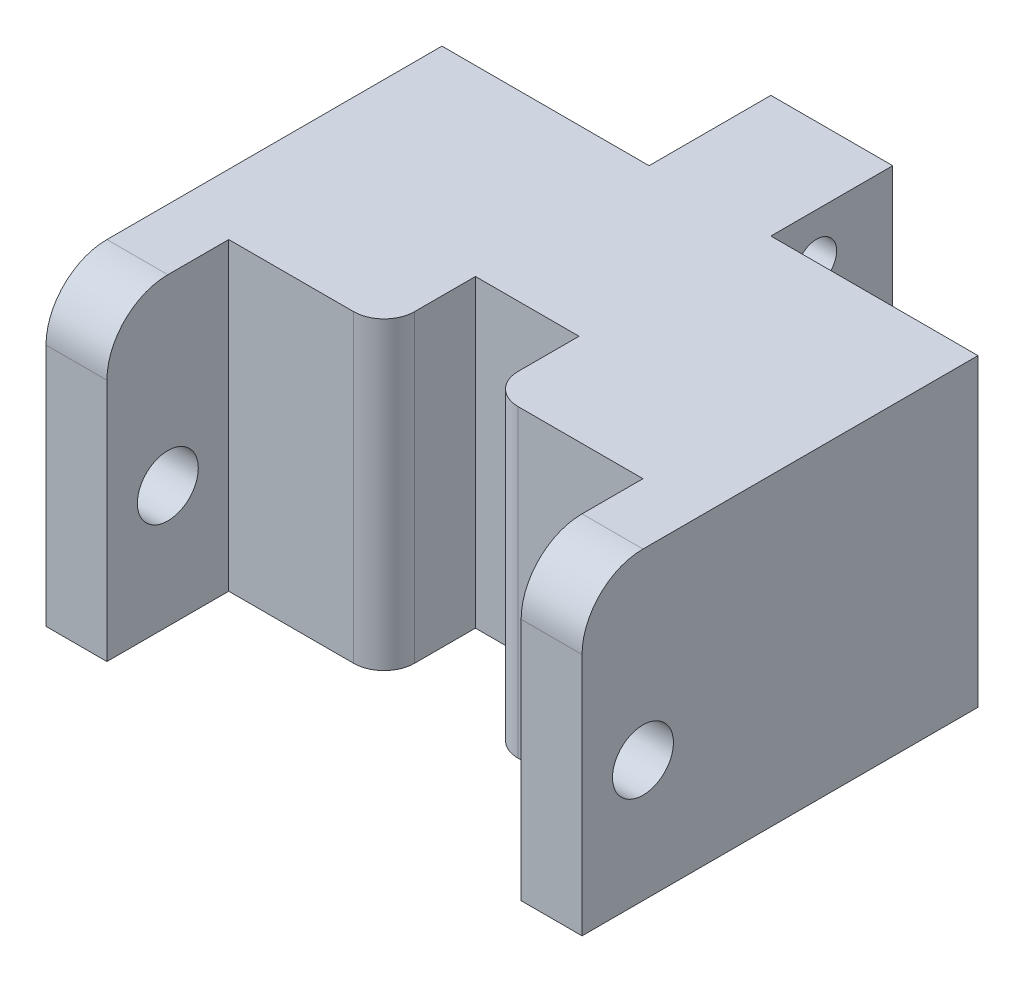
from build123d import *

# Parameters (mm, degrees)
BOSS_EXTRUDE2_DEPTH = 50
FILLET3_R           = 10
FILLET4_R           = 10
FILLET5_R           = 5
FILLET6_R           = 5
SKETCH3_W           = 20
SKETCH3_H           = 15
CUT_EXTRUDE2_DEPTH  = 37
SKETCH2_R           = 5
CUT_EXTRUDE3_DEPTH  = 115
CUT_EXTRUDE4_REACH  = 114.432
SKETCH4_R           = 3.3


with BuildPart() as part:
    # Sketch1 → Boss-Extrude2 (new body)
    with BuildSketch(Plane(origin=(0, 0, 0), x_dir=(1, 0, 0), z_dir=(0, 1, 0))):
        Polygon((20, 0), (0, 0), (0, -20), (-34, -20), (-34, -85), (-24, -85), (-24, -65), (1.5, -65), (1.5, -50), (18.5, -50), (18.5, -65), (44, -65), (44, -85), (54, -85), (54, -20), (20, -20), align=None)
    extrude(amount=BOSS_EXTRUDE2_DEPTH)

    # Fillet3
    fillet3_edges = [part.edges().sort_by_distance(p)[0] for p in [
        (-29, 50, 85),
    ]]
    fillet(fillet3_edges, radius=FILLET3_R)

    # Fillet4
    fillet4_edges = [part.edges().sort_by_distance(p)[0] for p in [
        (49, 50, 85),
    ]]
    fillet(fillet4_edges, radius=FILLET4_R)

    # Fillet5
    fillet5_edges = [part.edges().sort_by_distance(p)[0] for p in [
        (1.5, 25, 65),
    ]]
    fillet(fillet5_edges, radius=FILLET5_R)

    # Fillet6
    fillet6_edges = [part.edges().sort_by_distance(p)[0] for p in [
        (18.5, 25, 65),
    ]]
    fillet(fillet6_edges, radius=FILLET6_R)

    # Sketch3 → Cut-Extrude2 (cut)
    with BuildSketch(Plane.ZY):
        with Locations((10, 7.5)):
            Rectangle(SKETCH3_W, SKETCH3_H)
    extrude(amount=-CUT_EXTRUDE2_DEPTH, mode=Mode.SUBTRACT)

    # Sketch2 → Cut-Extrude3 (cut)
    with BuildSketch(Plane.ZY.offset(34)):
        with Locations((75, 20)):
            Circle(SKETCH2_R)
    extrude(amount=-CUT_EXTRUDE3_DEPTH, mode=Mode.SUBTRACT)

    # Sketch4 → Cut-Extrude4 (cut, up to next)
    with BuildSketch(Plane.ZY, mode=Mode.PRIVATE) as cut_extrude4_sk1:
        with Locations((12.5, 42.5)):
            Circle(SKETCH4_R)
    cut_extrude4_tool1 = extrude(cut_extrude4_sk1.sketch, amount=-CUT_EXTRUDE4_REACH, mode=Mode.PRIVATE) & part.part
    # Sketch4 → Cut-Extrude4 (cut, up to next)
    with BuildSketch(Plane.ZY, mode=Mode.PRIVATE) as cut_extrude4_sk2:
        with Locations((12.5, 27.5)):
            Circle(SKETCH4_R)
    cut_extrude4_tool2 = extrude(cut_extrude4_sk2.sketch, amount=-CUT_EXTRUDE4_REACH, mode=Mode.PRIVATE) & part.part
    add(cut_extrude4_tool1.solids().sort_by_distance((0, 42.5, 12.5))[0], mode=Mode.SUBTRACT)
    add(cut_extrude4_tool2.solids().sort_by_distance((0, 27.5, 12.5))[0], mode=Mode.SUBTRACT)


solid = part.part
